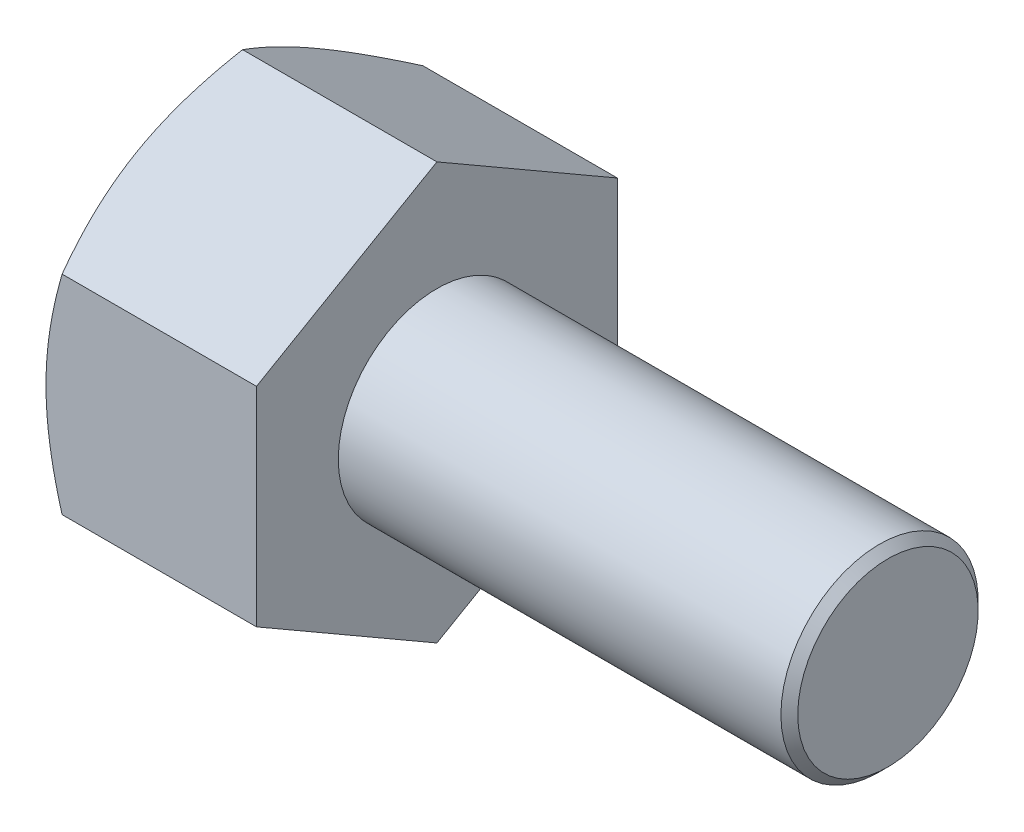
from build123d import *

# Parameters (mm, degrees)
BASEHEAD_DEPTH = 17.78


with BuildPart() as part:
    # Sketch1 → BaseHead (new body)
    with BuildSketch(Plane(origin=(0, 0, 0), x_dir=(0, 0, -1), z_dir=(1, 0, 0))):
        Polygon((15.24, 8.798818102), (15.24, -8.798818102), (0, -17.597636205), (-15.24, -8.798818102), (-15.24, 8.798818102), (0, 17.597636205), align=None)
    extrude(amount=BASEHEAD_DEPTH)

    # BodySke → BaseBody (revolve)
    with BuildSketch(Plane.XY, mode=Mode.PRIVATE) as basebody_sk:
        Polygon((0, 0), (55.88, 0), (55.88, 7.62), (55.1688, 8.3312), (0, 8.3312), align=None)
    revolve(basebody_sk.sketch.rotate(Axis((0, 0, 0), (1, 0, 0)), 90), axis=Axis((0, 0, 0), (1, 0, 0)))

    # Sketch3 → HeadChamfer (revolve, cut)
    with BuildSketch(Plane.XY):
        Polygon((0, 15.24), (5.027356107, 23.947636205), (5.027356107, 30.297636205), (-12.7, 30.297636205), (-12.7, 15.24), align=None)
    revolve(axis=Axis((0, 0, 0), (1, 0, 0)), mode=Mode.SUBTRACT)


solid = part.part
